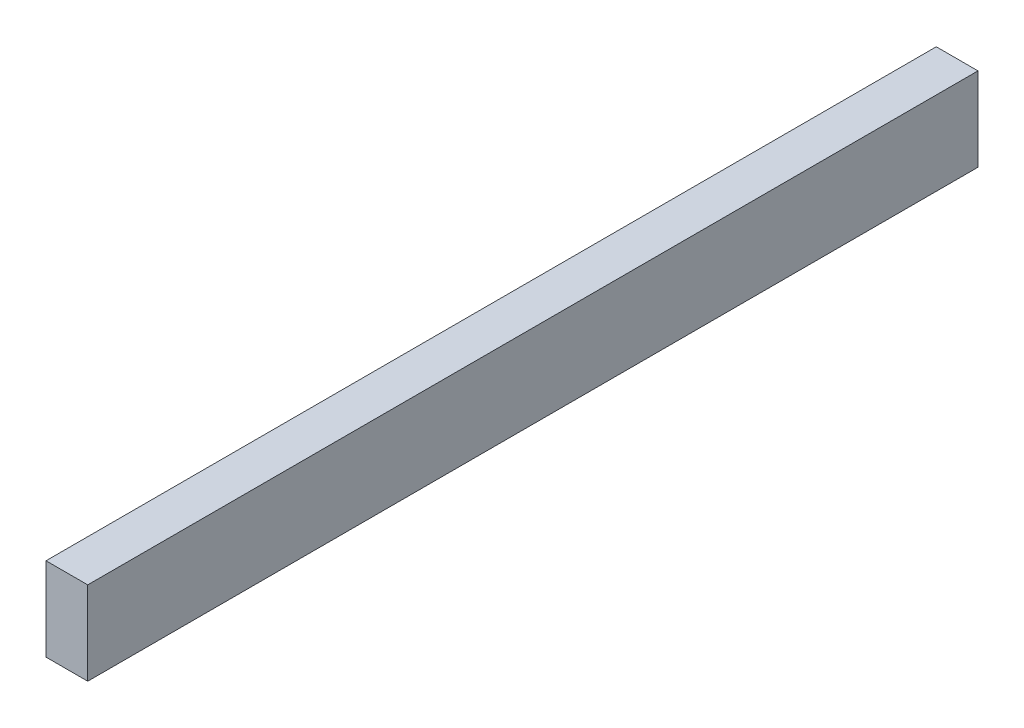
from build123d import *

# Parameters (mm, degrees)
ESBO_O1_W                = 320
ESBO_O1_H                = 30
RESSALTO_EXTRUS_O1_DEPTH = 15


with BuildPart() as part:
    # Esboço1 → Ressalto-extrusão1 (new body)
    with BuildSketch(Plane(origin=(0, 0, 0), x_dir=(0, 0, -1), z_dir=(1, 0, 0))):
        Rectangle(ESBO_O1_W, ESBO_O1_H)
    extrude(amount=RESSALTO_EXTRUS_O1_DEPTH)


solid = part.part
